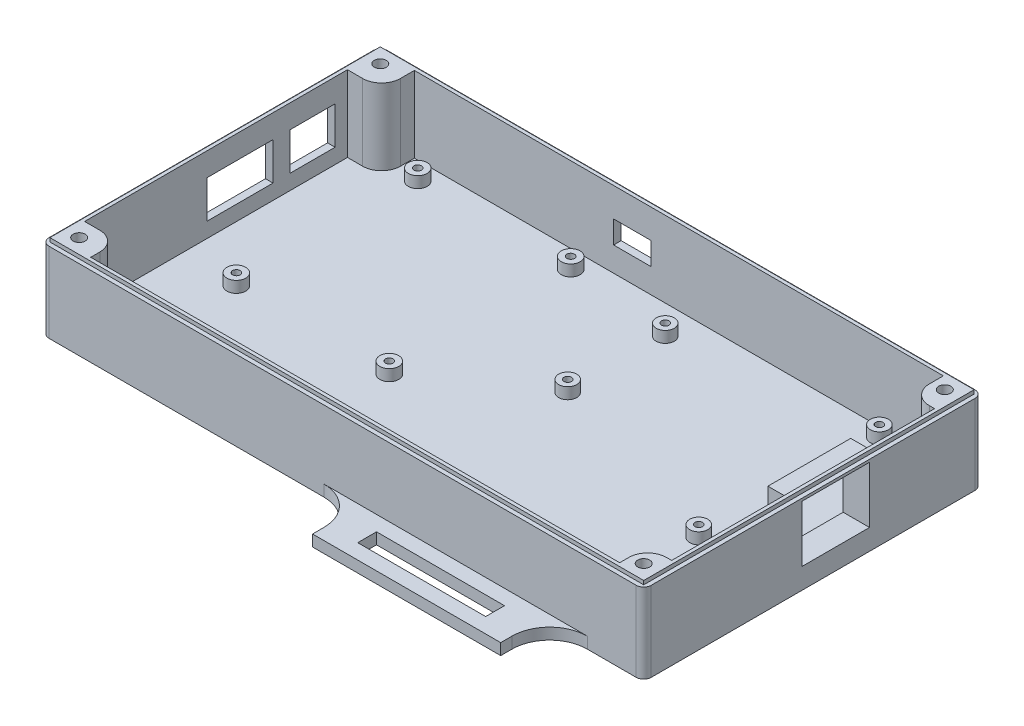
from build123d import *

# Parameters (mm, degrees)
SKETCH1_W           = 160
SKETCH1_H           = 90
BOSS_EXTRUDE1_DEPTH = 22.2
SHELL1_T            = -2
SKETCH2_W           = 9.051657133
SKETCH2_H           = 7.429819316
SKETCH2_W_2         = 6.377912523
SKETCH2_H_2         = 8.717812211
BOSS_EXTRUDE2_DEPTH = 20.2
SKETCH5_W           = 160
SKETCH5_H           = 90
SKETCH5_W_2         = 157.8
SKETCH5_H_2         = 87.8
CUT_EXTRUDE2_DEPTH  = 1
SKETCH6_R           = 1.6
CUT_EXTRUDE3_DEPTH  = 25
SKETCH13_R          = 3
CUT_EXTRUDE8_DEPTH  = 15
SKETCH14_W          = 50
SKETCH14_H          = 3
BOSS_EXTRUDE4_DEPTH = 13
SKETCH15_W          = 34
SKETCH15_H          = 5
CUT_EXTRUDE9_DEPTH  = 10
SKETCH16_W          = 50
SKETCH16_H          = 3
BOSS_EXTRUDE5_DEPTH = 13
SKETCH17_W          = 34
SKETCH17_H          = 5
CUT_EXTRUDE10_DEPTH = 10
SKETCH22_W          = 12
SKETCH22_H          = 10
SKETCH22_W_2        = 17.5
CUT_EXTRUDE15_DEPTH = 10
SKETCH23_W          = 10
SKETCH23_H          = 6
CUT_EXTRUDE16_DEPTH = 10
FILLET1_R           = 10
FILLET4_R           = 5
FILLET9_R           = 2
SKETCH26_R          = 2.5
SKETCH26_R_2        = 2.4
BOSS_EXTRUDE7_DEPTH = 3
SKETCH27_R          = 1
CUT_EXTRUDE17_DEPTH = 2
SKETCH28_W          = 22
SKETCH28_H          = 19.5
BOSS_EXTRUDE8_DEPTH = 5
SKETCH29_W          = 18
SKETCH29_H          = 15
CUT_EXTRUDE18_DEPTH = 17


with BuildPart() as part:
    # Sketch1 → Boss-Extrude1 (new body)
    with BuildSketch(Plane(origin=(0, 0, 0), x_dir=(1, 0, 0), z_dir=(0, 1, 0))):
        with Locations((80, 45)):
            Rectangle(SKETCH1_W, SKETCH1_H)
    extrude(amount=BOSS_EXTRUDE1_DEPTH)

    # Shell1
    shell1_openings = [part.faces().sort_by_distance(p)[0] for p in [
        (80, 22.2, -45),
    ]]
    offset(amount=SHELL1_T, openings=shell1_openings, kind=Kind.INTERSECTION)

    # Sketch2 → Boss-Extrude2 (add)
    with BuildSketch(Plane(origin=(0, 2, 0), x_dir=(1, 0, 0), z_dir=(0, 1, 0))):
        with Locations((6.525828567, 5.714909658)):
            Rectangle(SKETCH2_W, SKETCH2_H)
        with Locations((154.811043739, 83.641093895)):
            Rectangle(SKETCH2_W_2, SKETCH2_H_2)
        with Locations((154.811043739, 5.714909658)):
            Rectangle(SKETCH2_W_2, SKETCH2_H)
        with Locations((6.525828567, 83.641093895)):
            Rectangle(SKETCH2_W, SKETCH2_H_2)
    extrude(amount=BOSS_EXTRUDE2_DEPTH)

    # Sketch5 → Cut-Extrude2 (cut)
    with BuildSketch(Plane(origin=(0, 22.2, 0), x_dir=(1, 0, 0), z_dir=(0, 1, 0))):
        with Locations((80, 45)):
            Rectangle(SKETCH5_W, SKETCH5_H)
        with Locations((80, 45)):
            Rectangle(SKETCH5_W_2, SKETCH5_H_2, mode=Mode.SUBTRACT)
    extrude(amount=-CUT_EXTRUDE2_DEPTH, mode=Mode.SUBTRACT)

    # Sketch6 → Cut-Extrude3 (cut)
    with BuildSketch(Plane(origin=(0, 22.2, 0), x_dir=(1, 0, 0), z_dir=(0, 1, 0))):
        with Locations(Location((155, 85, 0), (0, 0, 270))):
            Circle(SKETCH6_R)
        with Locations(Location((155, 5, 0), (0, 0, 270))):
            Circle(SKETCH6_R)
        with Locations(Location((5, 85, 0), (0, 0, 270))):
            Circle(SKETCH6_R)
        with Locations(Location((5, 5, 0), (0, 0, 270))):
            Circle(SKETCH6_R)
    extrude(amount=-CUT_EXTRUDE3_DEPTH, mode=Mode.SUBTRACT)

    # Sketch13 → Cut-Extrude8 (cut)
    with BuildSketch(Plane.XZ):
        with Locations(Location((155, -5, 0), (0, 0, 270))):
            Circle(SKETCH13_R)
        with Locations(Location((155, -85, 0), (0, 0, 270))):
            Circle(SKETCH13_R)
        with Locations(Location((5, -5, 0), (0, 0, 270))):
            Circle(SKETCH13_R)
        with Locations(Location((5, -85, 0), (0, 0, 270))):
            Circle(SKETCH13_R)
    extrude(amount=-CUT_EXTRUDE8_DEPTH, mode=Mode.SUBTRACT)

    # Sketch14 → Boss-Extrude4 (add)
    with BuildSketch(Plane.XY):
        with Locations((110, 1.5)):
            Rectangle(SKETCH14_W, SKETCH14_H)
    extrude(amount=BOSS_EXTRUDE4_DEPTH)

    # Sketch15 → Cut-Extrude9 (cut)
    with BuildSketch(Plane(origin=(0, 0, 0), x_dir=(-1, 0, 0), z_dir=(0, -1, 0))):
        with Locations((-110, -6.5)):
            Rectangle(SKETCH15_W, SKETCH15_H)
    extrude(amount=-CUT_EXTRUDE9_DEPTH, mode=Mode.SUBTRACT)

    # Sketch16 → Boss-Extrude5 (add)
    with BuildSketch(Plane(origin=(0, 0, -90), x_dir=(-1, 0, 0), z_dir=(0, 0, -1))):
        with Locations((-110, 1.5)):
            Rectangle(SKETCH16_W, SKETCH16_H)
    extrude(amount=BOSS_EXTRUDE5_DEPTH)

    # Sketch17 → Cut-Extrude10 (cut)
    with BuildSketch(Plane(origin=(0, 0, 0), x_dir=(-1, 0, 0), z_dir=(0, -1, 0))):
        with Locations((-110, 96.5)):
            Rectangle(SKETCH17_W, SKETCH17_H)
    extrude(amount=-CUT_EXTRUDE10_DEPTH, mode=Mode.SUBTRACT)

    # Sketch22 → Cut-Extrude15 (cut)
    with BuildSketch(Plane.ZY):
        with Locations((-70, 11)):
            Rectangle(SKETCH22_W, SKETCH22_H)
        with Locations((-50.75, 11)):
            Rectangle(SKETCH22_W_2, SKETCH22_H)
    extrude(amount=-CUT_EXTRUDE15_DEPTH, mode=Mode.SUBTRACT)

    # Sketch23 → Cut-Extrude16 (cut)
    with BuildSketch(Plane(origin=(0, 0, -90), x_dir=(-1, 0, 0), z_dir=(0, 0, -1))):
        with Locations((-69, 11.5)):
            Rectangle(SKETCH23_W, SKETCH23_H)
    extrude(amount=-CUT_EXTRUDE16_DEPTH, mode=Mode.SUBTRACT)

    # Fillet1
    fillet1_edges = [part.edges().sort_by_distance(p)[0] for p in [
        (135, 1.5, 0),
        (85, 1.5, 0),
        (135, 1.5, -90),
        (85, 1.5, -90),
    ]]
    fillet(fillet1_edges, radius=FILLET1_R)

    # Fillet4
    fillet4_edges = [part.edges().sort_by_distance(p)[0] for p in [
        (11.051657133, 12.1, -9.429819316),
        (151.622087477, 12.1, -79.282187789),
        (11.051657133, 12.1, -79.282187789),
        (151.622087477, 12.1, -9.429819316),
    ]]
    fillet(fillet4_edges, radius=FILLET4_R)

    # Fillet9
    fillet9_edges = [part.edges().sort_by_distance(p)[0] for p in [
        (0, 10.6, -90),
        (160, 10.6, -90),
        (160, 10.6, 0),
        (0, 10.6, 0),
    ]]
    fillet(fillet9_edges, radius=FILLET9_R)

    # Sketch26 → Boss-Extrude7 (add)
    with BuildSketch(Plane(origin=(0, 2, 0), x_dir=(1, 0, 0), z_dir=(0, 1, 0))):
        with Locations(Location((16.75, 83.2, 0), (0, 0, 90))):
            Circle(SKETCH26_R)
        with Locations(Location((16.75, 35, 0), (0, 0, 90))):
            Circle(SKETCH26_R)
        with Locations(Location((57.4, 35, 0), (0, 0, 90))):
            Circle(SKETCH26_R)
        with Locations(Location((57.4, 83.2, 0), (0, 0, 90))):
            Circle(SKETCH26_R)
        with Locations(Location((137.122087477, 85.5, 0), (0, 0, 90))):
            Circle(SKETCH26_R_2)
        with Locations(Location((136.122087477, 38.5, 0), (0, 0, 90))):
            Circle(SKETCH26_R_2)
        with Locations(Location((85.322087477, 54.478431373, 0), (0, 0, 90))):
            Circle(SKETCH26_R_2)
        with Locations(Location((85.322087477, 80.4, 0), (0, 0, 90))):
            Circle(SKETCH26_R_2)
    extrude(amount=BOSS_EXTRUDE7_DEPTH)

    # Sketch27 → Cut-Extrude17 (cut)
    with BuildSketch(Plane(origin=(0, 5, 0), x_dir=(1, 0, 0), z_dir=(0, 1, 0))):
        with Locations(Location((57.4, 83.2, 0), (0, 0, 270))):
            Circle(SKETCH27_R)
        with Locations(Location((57.4, 35, 0), (0, 0, 270))):
            Circle(SKETCH27_R)
        with Locations(Location((16.75, 35, 0), (0, 0, 270))):
            Circle(SKETCH27_R)
        with Locations(Location((16.75, 83.2, 0), (0, 0, 270))):
            Circle(SKETCH27_R)
        with Locations(Location((136.122087477, 38.5, 0), (0, 0, 270))):
            Circle(SKETCH27_R)
        with Locations(Location((137.122087477, 85.5, 0), (0, 0, 270))):
            Circle(SKETCH27_R)
        with Locations(Location((85.322087477, 80.4, 0), (0, 0, 270))):
            Circle(SKETCH27_R)
        with Locations(Location((85.322087477, 54.478431373, 0), (0, 0, 270))):
            Circle(SKETCH27_R)
    extrude(amount=-CUT_EXTRUDE17_DEPTH, mode=Mode.SUBTRACT)

    # Sketch28 → Boss-Extrude8 (add)
    with BuildSketch(Plane.ZY.offset(-158)):
        with Locations((-51, 11.75)):
            Rectangle(SKETCH28_W, SKETCH28_H)
    extrude(amount=BOSS_EXTRUDE8_DEPTH)

    # Sketch29 → Cut-Extrude18 (cut)
    with BuildSketch(Plane.ZY.offset(-153)):
        with Locations((-51, 13)):
            Rectangle(SKETCH29_W, SKETCH29_H)
    extrude(amount=-CUT_EXTRUDE18_DEPTH, mode=Mode.SUBTRACT)


solid = part.part
